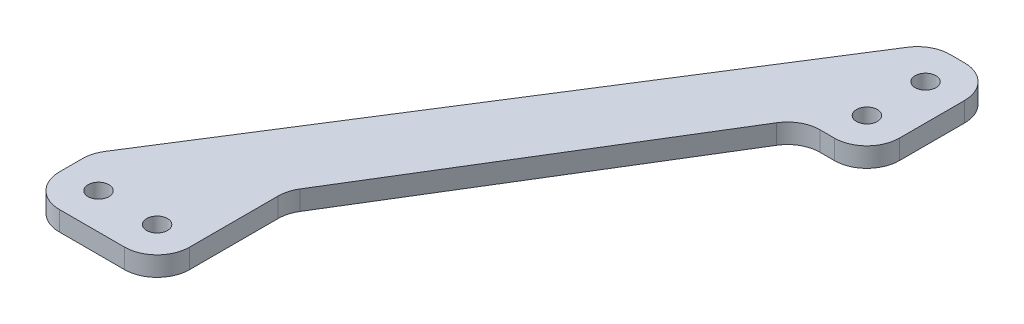
from build123d import *

# Parameters (mm, degrees)
SKETCH_1_R      = 1.6
EXTRUDE_1_DEPTH = 3
FILLET_1_R      = 5


with BuildPart() as part:
    # 草图1 → 凸台-拉伸1 (new body)
    with BuildSketch(Plane(origin=(0, 0, 0), x_dir=(1, 0, 0), z_dir=(0, 1, 0))):
        Polygon((50, 89), (0, 10), (0, 0), (20, 0), (20, 20), (50, 69), (60, 69), (60, 89), align=None)
        with Locations(Location((54.5, 83.5, 0), (0, 0, 270))):
            Circle(SKETCH_1_R, mode=Mode.SUBTRACT)
        with Locations(Location((54.5, 74.5, 0), (0, 0, 90))):
            Circle(SKETCH_1_R, mode=Mode.SUBTRACT)
        with Locations(Location((5.5, 5.5, 0), (0, 0, 270))):
            Circle(SKETCH_1_R, mode=Mode.SUBTRACT)
        with Locations(Location((14.5, 5.5, 0), (0, 0, 270))):
            Circle(SKETCH_1_R, mode=Mode.SUBTRACT)
    extrude(amount=EXTRUDE_1_DEPTH)

    # 圆角1
    fillet_1_edges = [part.edges().sort_by_distance(p)[0] for p in [
        (0, 1.5, 0),
        (0, 1.5, -10),
        (50, 1.5, -89),
        (60, 1.5, -89),
        (60, 1.5, -69),
        (50, 1.5, -69),
        (20, 1.5, -20),
        (20, 1.5, 0),
    ]]
    fillet(fillet_1_edges, radius=FILLET_1_R)


solid = part.part
